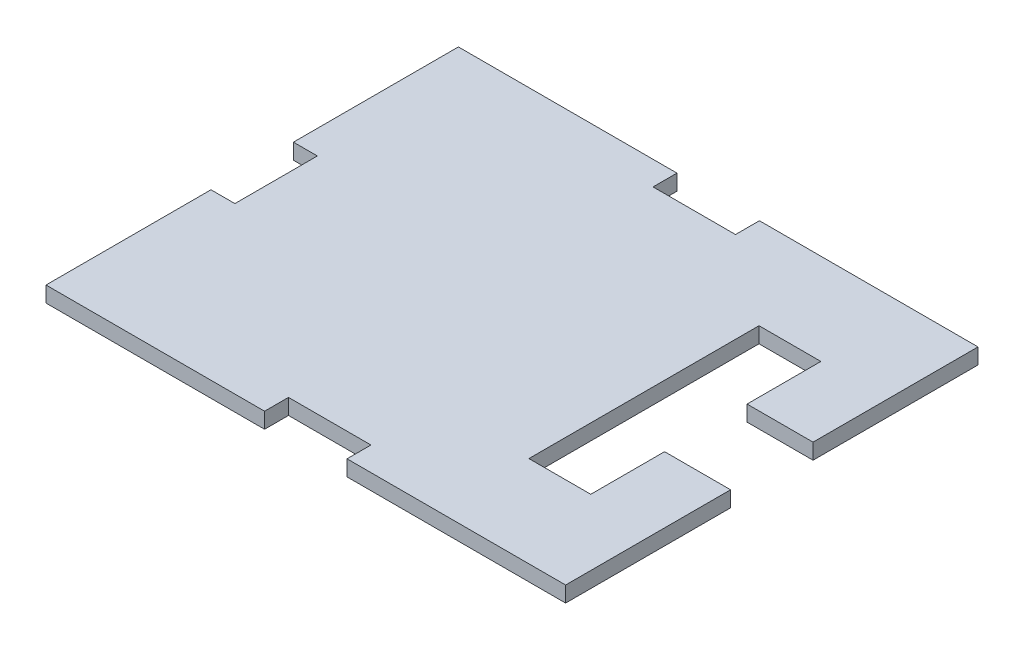
from build123d import *

# Parameters (mm, degrees)
BOSS_EXTRUDE1_DEPTH = 4.826
CUT_EXTRUDE1_DEPTH  = 4.826


with BuildPart() as part:
    # Sketch1 → Boss-Extrude1 (new body)
    with BuildSketch(Plane(origin=(0, 0, 0), x_dir=(1, 0, 0), z_dir=(0, 1, 0))):
        Polygon((-80.01, 63.5), (-12.7, 63.5), (-12.7, 56.134), (12.7, 56.134), (12.7, 63.5), (80.01, 63.5), (80.01, 12.7), (72.644, 12.7), (72.644, -12.7), (80.01, -12.7), (80.01, -63.5), (12.7, -63.5), (12.7, -56.134), (-12.7, -56.134), (-12.7, -63.5), (-80.01, -63.5), (-80.01, -12.7), (-72.644, -12.7), (-72.644, 12.7), (-80.01, 12.7), align=None)
    extrude(amount=BOSS_EXTRUDE1_DEPTH)

    # Sketch3 → Cut-Extrude1 (cut)
    with BuildSketch(Plane(origin=(0, 4.826, 0), x_dir=(1, 0, 0), z_dir=(0, 1, 0))):
        Polygon((59.69, -35.433), (40.64, -35.433), (40.64, 35.433), (59.69, 35.433), (59.69, 12.7), (72.644, 12.7), (72.644, -12.7), (59.69, -12.7), align=None)
    extrude(amount=-CUT_EXTRUDE1_DEPTH, mode=Mode.SUBTRACT)


solid = part.part
